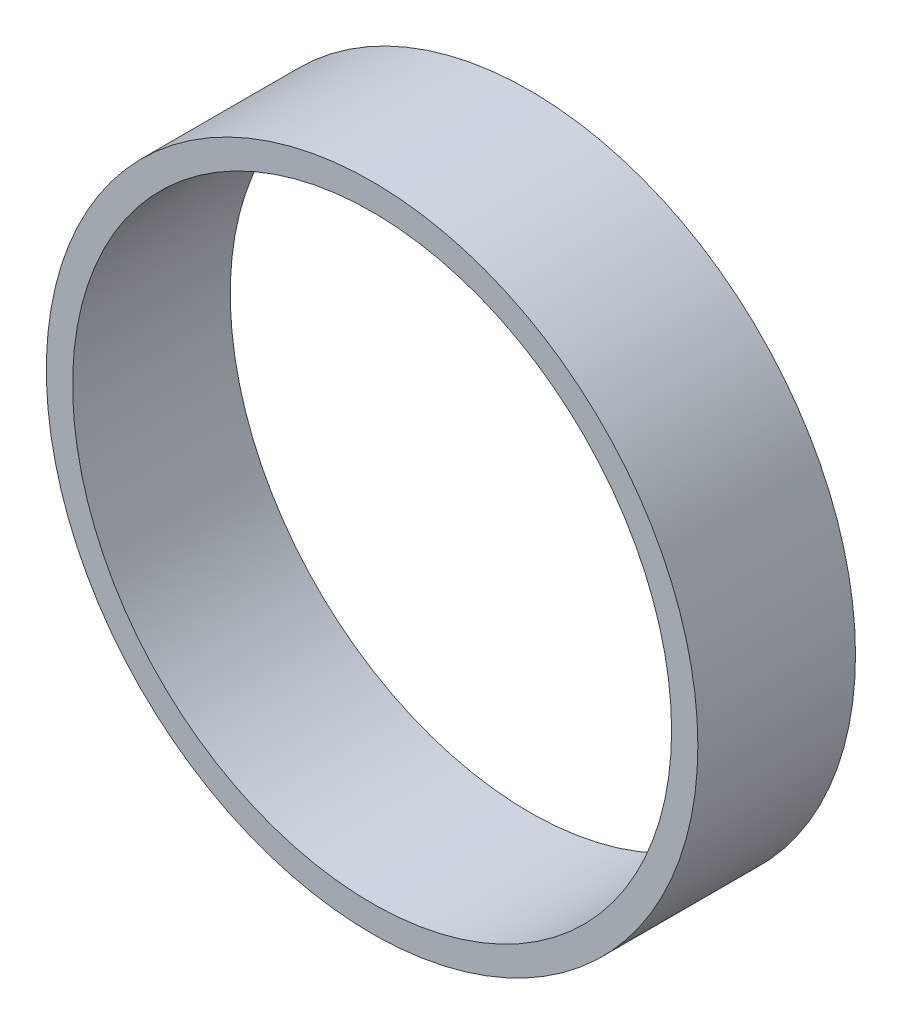
from build123d import *

# Parameters (mm, degrees)
SKETCH1_R           = 31
SKETCH1_R_2         = 28.5
BOSS_EXTRUDE1_DEPTH = 15


with BuildPart() as part:
    # Sketch1 → Boss-Extrude1 (new body)
    with BuildSketch(Plane.XY):
        Circle(SKETCH1_R)
        Circle(SKETCH1_R_2, mode=Mode.SUBTRACT)
    extrude(amount=BOSS_EXTRUDE1_DEPTH)


solid = part.part
